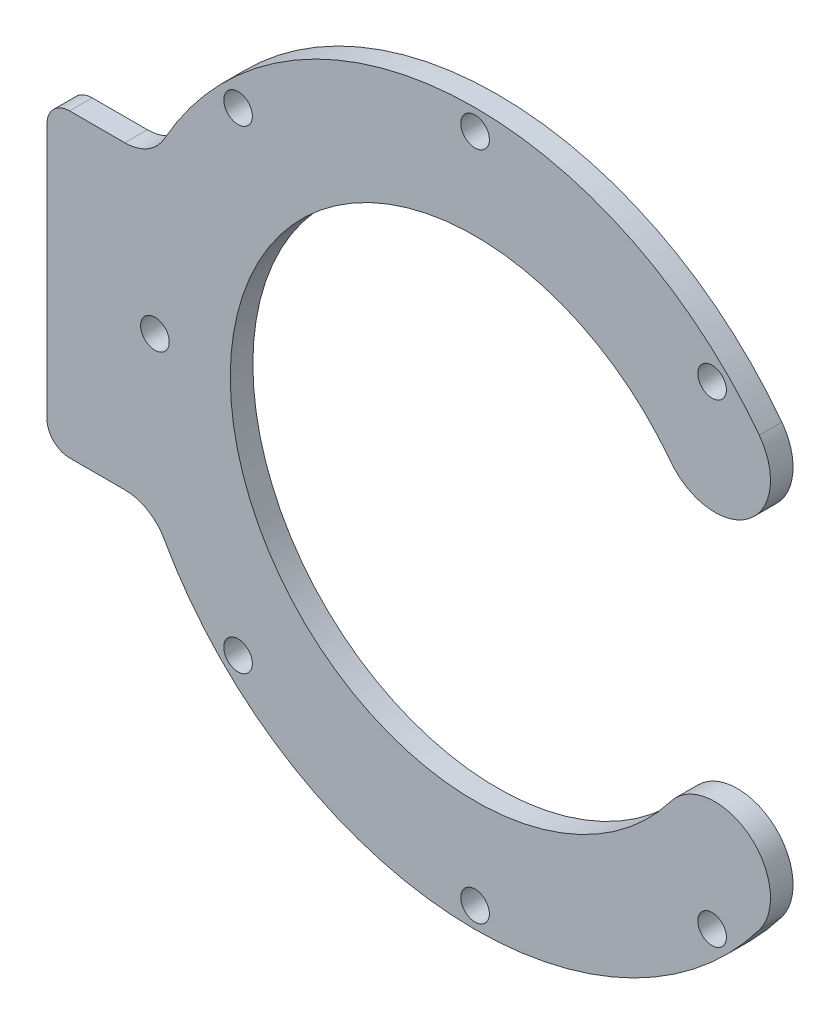
from build123d import *

# Parameters (mm, degrees)
SKETCH_1_R          = 47.25
SKETCH_1_R_2        = 1.9
SKETCH_1_R_3        = 32.5
EXTRUDE_1_DEPTH     = 3
CUT_EXTRUDE_START   = -3
CUT_EXTRUDE_1_DEPTH = 3
EXTRUDE_2_DEPTH     = 3
FILLET_1_R          = 3
FILLET_2_R          = 6


with BuildPart() as part:
    # 草图1 → 凸台-拉伸1 (new body)
    with BuildSketch(Plane.XY):
        Circle(SKETCH_1_R)
        with Locations((-31.466251763, -31.466251763)):
            Circle(SKETCH_1_R_2, mode=Mode.SUBTRACT)
        with Locations((-42.5, 0)):
            Circle(SKETCH_1_R_2, mode=Mode.SUBTRACT)
        Circle(SKETCH_1_R_3, mode=Mode.SUBTRACT)
        with Locations((0, -44.5)):
            Circle(SKETCH_1_R_2, mode=Mode.SUBTRACT)
        with Locations((31.466251763, -31.466251763)):
            Circle(SKETCH_1_R_2, mode=Mode.SUBTRACT)
        with Locations((-31.466251763, 31.466251763)):
            Circle(SKETCH_1_R_2, mode=Mode.SUBTRACT)
        with Locations((0, 44.5)):
            Circle(SKETCH_1_R_2, mode=Mode.SUBTRACT)
        with Locations((42.5, 0)):
            Circle(SKETCH_1_R_2, mode=Mode.SUBTRACT)
        with Locations((31.466251763, 31.466251763)):
            Circle(SKETCH_1_R_2, mode=Mode.SUBTRACT)
    extrude(amount=EXTRUDE_1_DEPTH)

    # 草图2 → 切除-拉伸1 (cut)
    with BuildSketch(Plane.XY.offset(3).offset(CUT_EXTRUDE_START)):
        with BuildLine():
            ThreePointArc((40.6, 0), (42.5, 1.9), (44.4, 0))
            Line((44.4, 0), (47.25, 0))
            ThreePointArc((47.25, 0), (44.807674543, 14.994492391), (37.733182981, 28.438871323))
            ThreePointArc((37.733182981, 28.438871323), (38.837402493, 26.340410113), (39.218611997, 24))
            ThreePointArc((39.218611997, 24), (34.184022114, 17.006209505), (25.954041018, 19.561128669))
            ThreePointArc((25.954041018, 19.561128669), (30.820093552, 10.313672161), (32.5, 0))
            Line((32.5, 0), (40.6, 0))
        make_face()
        with BuildLine():
            Line((47.25, 0), (44.4, 0))
            ThreePointArc((44.4, 0), (42.5, -1.9), (40.6, 0))
            Line((40.6, 0), (32.5, 0))
            ThreePointArc((32.5, 0), (30.820093563, -10.313672127), (25.954041062, -19.561128611))
            ThreePointArc((25.954041062, -19.561128611), (34.184022149, -17.006209517), (39.218611997, -24))
            ThreePointArc((39.218611997, -24), (38.837402455, -26.340410225), (37.733182838, -28.438871512))
            ThreePointArc((37.733182838, -28.438871512), (44.807674505, -14.994492504), (47.25, 0))
        make_face()
    extrude(amount=CUT_EXTRUDE_1_DEPTH, mode=Mode.SUBTRACT)


with BuildPart() as cut_extrude_1_kept_piece:
    # of the separate pieces the step leaves, the one the design keeps (cut_extrude_1_pieces_kept)
    add(part.part.solids().sort_by_distance((-29.566251763, -31.466251763, 3))[0])

    # 草图3 → 凸台-拉伸2 (add)
    with BuildSketch(Plane.XY.offset(3)):
        with BuildLine():
            Line((-42.831763914, 19.95), (-56.831763914, 19.95))
            Line((-56.831763914, 19.95), (-56.831763914, 0))
            Line((-56.831763914, 0), (-47.25, 0))
            ThreePointArc((-47.25, 0), (-46.132219462, 10.216693571), (-42.831763914, 19.95))
        make_face()
        with BuildLine():
            Line((-47.25, 0), (-56.831763914, 0))
            Line((-56.831763914, 0), (-56.831763914, -19.95))
            Line((-56.831763914, -19.95), (-42.831763914, -19.95))
            ThreePointArc((-42.831763914, -19.95), (-46.132219462, -10.216693571), (-47.25, 0))
        make_face()
    extrude(amount=-EXTRUDE_2_DEPTH)

    # 圆角1
    fillet_1_edges = [cut_extrude_1_kept_piece.edges().sort_by_distance(p)[0] for p in [
        (-56.831763914, -19.95, 1.5),
        (-56.831763914, 19.95, 1.5),
    ]]
    fillet(fillet_1_edges, radius=FILLET_1_R)

    # 圆角2
    fillet_2_edges = [cut_extrude_1_kept_piece.edges().sort_by_distance(p)[0] for p in [
        (-42.831763914, 19.95, 1.5),
        (-42.831763914, -19.95, 1.5),
    ]]
    fillet(fillet_2_edges, radius=FILLET_2_R)


solid = cut_extrude_1_kept_piece.part
